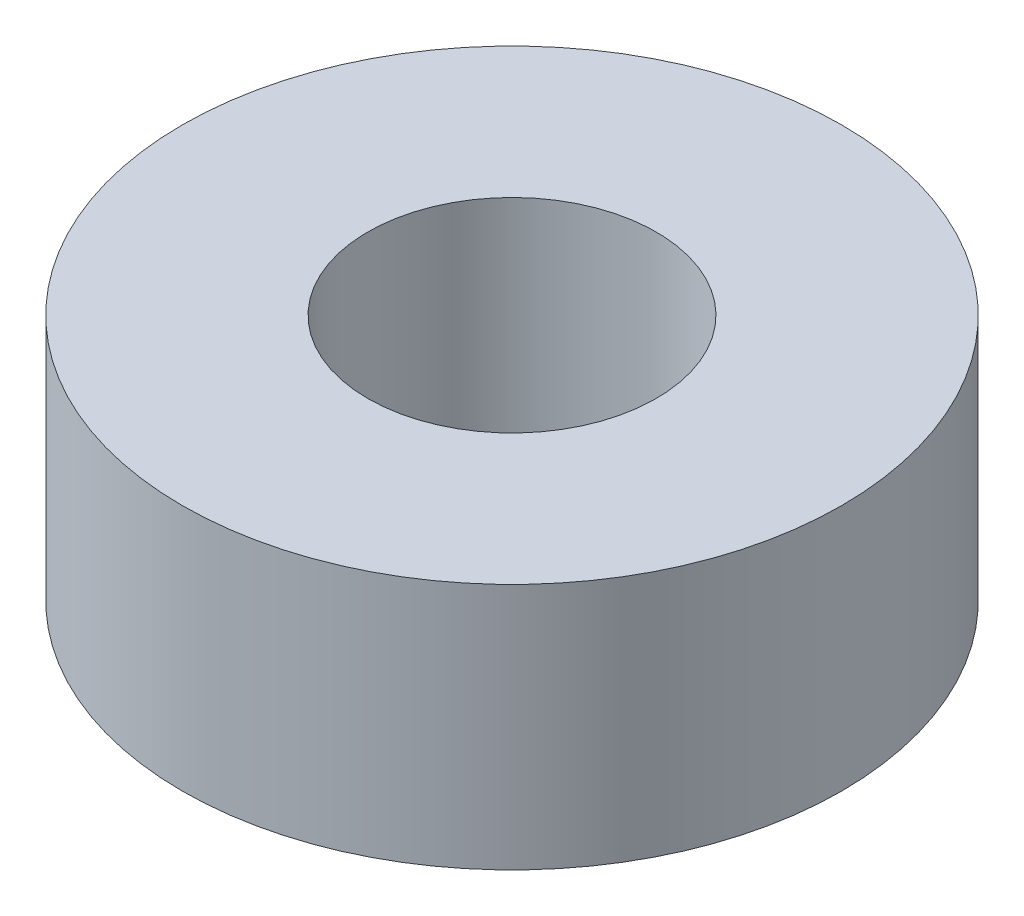
from build123d import *

# Parameters (mm, degrees)
SKETCH_1_R      = 4
SKETCH_1_R_2    = 1.75
EXTRUDE_1_DEPTH = 3


with BuildPart() as part:
    # Эскиз1 → Бобышка-Вытянуть1 (new body)
    with BuildSketch(Plane(origin=(0, 0, 0), x_dir=(1, 0, 0), z_dir=(0, 1, 0))):
        with Locations(Location((0, 0, 0), (0, 0, 270))):
            Circle(SKETCH_1_R)
        with Locations(Location((0, 0, 0), (0, 0, 270))):
            Circle(SKETCH_1_R_2, mode=Mode.SUBTRACT)
    extrude(amount=EXTRUDE_1_DEPTH)


solid = part.part
